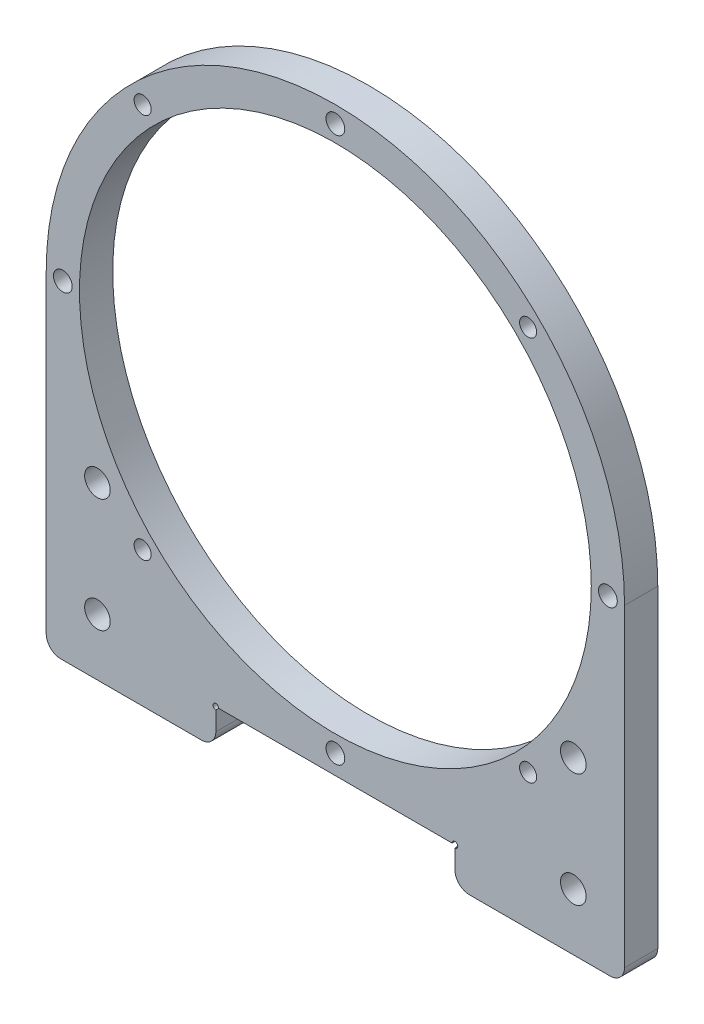
from build123d import *

# Parameters (mm, degrees)
SKETCH1_R           = 2.25
SKETCH1_R_2         = 44.958
SKETCH1_R_3         = 1.65
SKETCH1_R_4         = 1.5
BOSS_EXTRUDE1_DEPTH = 5.842
SKETCH2_W           = 42
SKETCH2_H           = 6.35
CUT_EXTRUDE1_DEPTH  = 78.066295668
SKETCH3_R           = 0.5
CUT_EXTRUDE2_DEPTH  = 78.066295668
FILLET1_R           = 2.54


with BuildPart() as part:
    # Sketch1 → Boss-Extrude1 (new body)
    with BuildSketch(Plane.XY):
        with BuildLine():
            Line((-50.8, 0), (-50.8, -57.658))
            Line((-50.8, -57.658), (50.8, -57.658))
            Line((50.8, -57.658), (50.8, 0))
            ThreePointArc((50.8, 0), (0, 50.8), (-50.8, 0))
        make_face()
        with Locations((41.8, -47.658)):
            Circle(SKETCH1_R, mode=Mode.SUBTRACT)
        Circle(SKETCH1_R_2, mode=Mode.SUBTRACT)
        with Locations((-47.879, 0)):
            Circle(SKETCH1_R_3, mode=Mode.SUBTRACT)
        with Locations((0, 47.879)):
            Circle(SKETCH1_R_3, mode=Mode.SUBTRACT)
        with Locations((41.8, -27.658)):
            Circle(SKETCH1_R, mode=Mode.SUBTRACT)
        with Locations((47.879, 0)):
            Circle(SKETCH1_R_3, mode=Mode.SUBTRACT)
        with Locations((0, -47.879)):
            Circle(SKETCH1_R_3, mode=Mode.SUBTRACT)
        with Locations((-41.8, -27.658)):
            Circle(SKETCH1_R, mode=Mode.SUBTRACT)
        with Locations((-33.855565576, 33.855565576)):
            Circle(SKETCH1_R_4, mode=Mode.SUBTRACT)
        with Locations((33.855565576, 33.855565576)):
            Circle(SKETCH1_R_4, mode=Mode.SUBTRACT)
        with Locations((33.855565576, -33.855565576)):
            Circle(SKETCH1_R_4, mode=Mode.SUBTRACT)
        with Locations((-33.855565576, -33.855565576)):
            Circle(SKETCH1_R_4, mode=Mode.SUBTRACT)
        with Locations((-41.8, -47.658)):
            Circle(SKETCH1_R, mode=Mode.SUBTRACT)
    extrude(amount=BOSS_EXTRUDE1_DEPTH)

    # Sketch2 → Cut-Extrude1 (cut, through all)
    with BuildSketch(Plane.XY.offset(5.842)):
        with Locations((0, -54.483)):
            Rectangle(SKETCH2_W, SKETCH2_H)
    extrude(amount=-CUT_EXTRUDE1_DEPTH, mode=Mode.SUBTRACT)

    # Sketch3 → Cut-Extrude2 (cut, through all)
    with BuildSketch(Plane.XY.offset(5.842)):
        with Locations((-21, -51.308)):
            Circle(SKETCH3_R)
        with Locations((21, -51.308)):
            Circle(SKETCH3_R)
    extrude(amount=-CUT_EXTRUDE2_DEPTH, mode=Mode.SUBTRACT)

    # Fillet1
    fillet1_edges = [part.edges().sort_by_distance(p)[0] for p in [
        (50.8, -57.658, 2.921),
        (-50.8, -57.658, 2.921),
        (-21, -57.658, 2.921),
        (21, -57.658, 2.921),
    ]]
    fillet(fillet1_edges, radius=FILLET1_R)


solid = part.part
